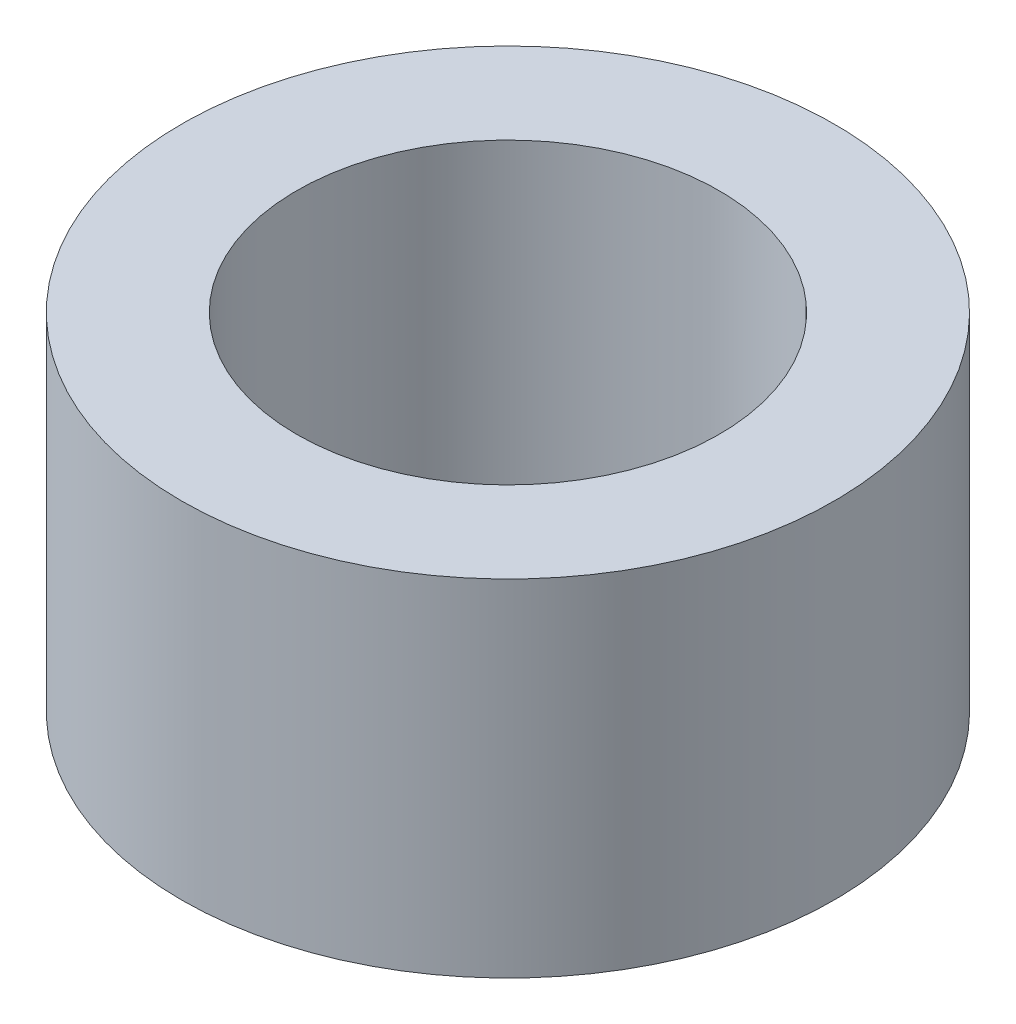
from build123d import *

# Parameters (mm, degrees)
SKETCH1_R           = 4.25
SKETCH1_R_2         = 2.75
BOSS_EXTRUDE1_DEPTH = 4.5


with BuildPart() as part:
    # Sketch1 → Boss-Extrude1 (new body)
    with BuildSketch(Plane(origin=(0, 0, 0), x_dir=(1, 0, 0), z_dir=(0, 1, 0))):
        Circle(SKETCH1_R)
        Circle(SKETCH1_R_2, mode=Mode.SUBTRACT)
    extrude(amount=BOSS_EXTRUDE1_DEPTH)


solid = part.part
